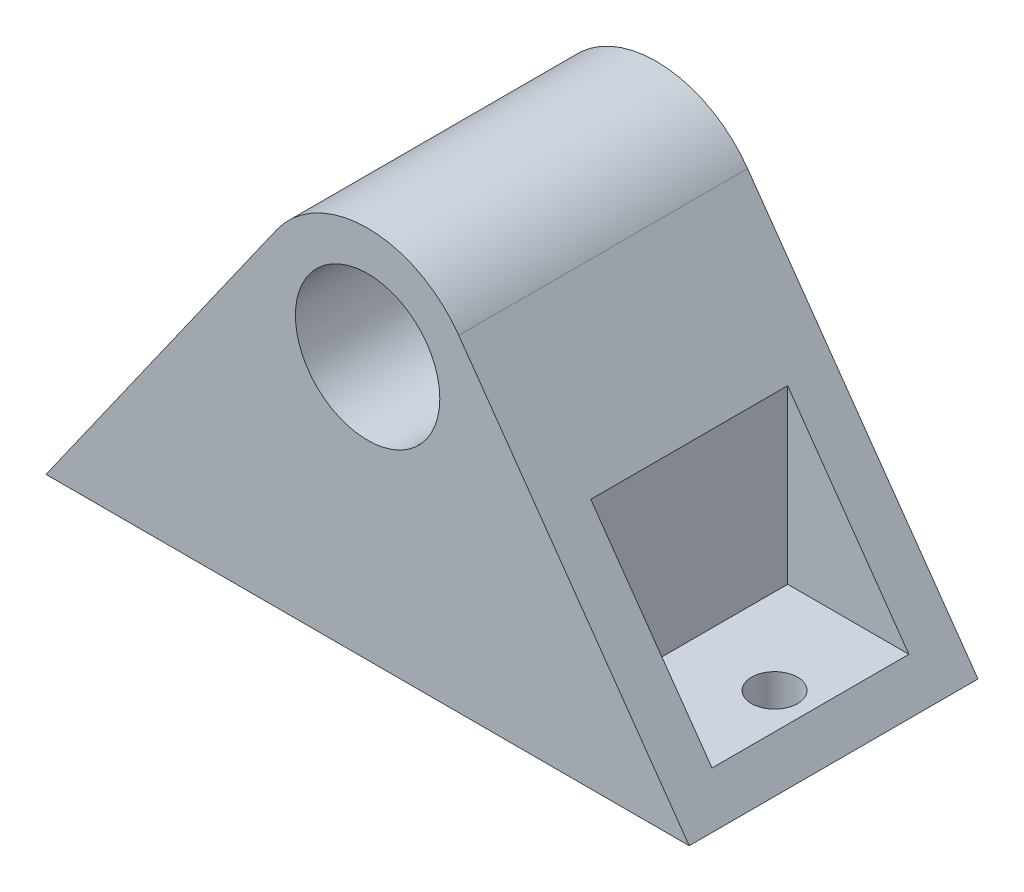
from build123d import *

# Parameters (mm, degrees)
SKETCH1_R               = 5.5
BLOCO_DEPTH             = 11
SKETCH2_W               = 11
SKETCH2_H               = 15
RASGOS_LATERAIS_DEPTH   = 26
SKETCH3_R               = 1.75
FUROS_DE_FIXA_O_4_DEPTH = 38.379807383


with BuildPart() as part:
    # Sketch1 → Bloco (new, symmetric)
    with BuildSketch(Plane.XY):
        with BuildLine():
            Line((-6.947113934, 24.897714569), (-24.5, 0))
            Line((-24.5, 0), (24.5, 0))
            Line((24.5, 0), (6.947113934, 24.897714569))
            ThreePointArc((6.947113934, 24.897714569), (0, 28.5), (-6.947113934, 24.897714569))
        make_face()
        with Locations((0, 20)):
            Circle(SKETCH1_R, mode=Mode.SUBTRACT)
    extrude(amount=BLOCO_DEPTH, both=True)

    # Sketch2 → Rasgos Laterais (cut)
    with BuildSketch(Plane(origin=(0, 28.5, 0), x_dir=(1, 0, 0), z_dir=(0, 1, 0))):
        with Locations((19, 0)):
            Rectangle(SKETCH2_W, SKETCH2_H)
        with Locations((-19, 0)):
            Rectangle(SKETCH2_W, SKETCH2_H)
    extrude(amount=-RASGOS_LATERAIS_DEPTH, mode=Mode.SUBTRACT)

    # Sketch3 → Furos de Fixação Ø4 (cut, through all)
    with BuildSketch(Plane(origin=(0, 2.5, 0), x_dir=(1, 0, 0), z_dir=(0, 1, 0))):
        with Locations(Location((20, 0, 0), (0, 0, 270))):
            Circle(SKETCH3_R)
        with Locations(Location((-20, 0, 0), (0, 0, 90))):
            Circle(SKETCH3_R)
    extrude(amount=-FUROS_DE_FIXA_O_4_DEPTH, mode=Mode.SUBTRACT)


solid = part.part
